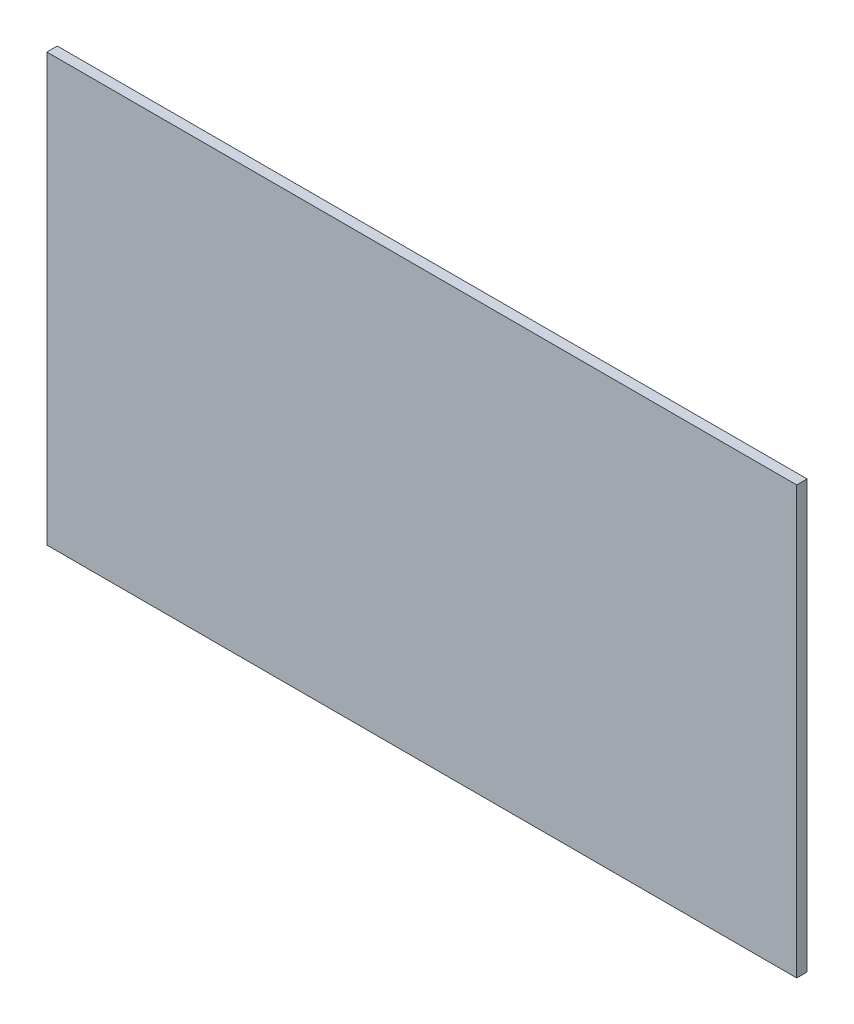
from build123d import *

# Parameters (mm, degrees)
SKETCH1_W           = 1828.8
SKETCH1_H           = 1041.4
BOSS_EXTRUDE1_DEPTH = 25.4


with BuildPart() as part:
    # Sketch1 → Boss-Extrude1 (new body)
    with BuildSketch(Plane.XY):
        Rectangle(SKETCH1_W, SKETCH1_H)
    extrude(amount=BOSS_EXTRUDE1_DEPTH)


solid = part.part
